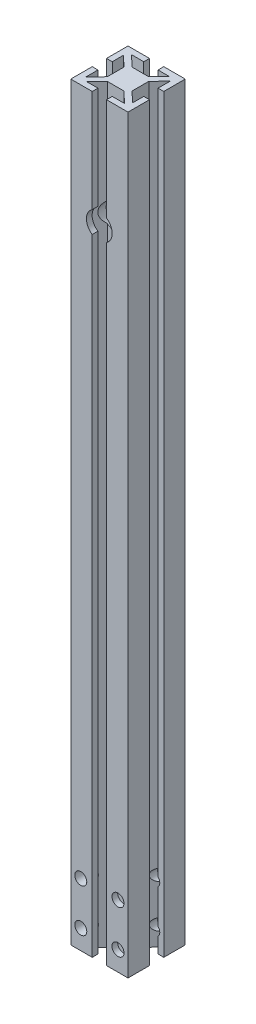
from build123d import *
from build123d.topology import SkipClean

# Parameters (mm, degrees)
SKETCH2_W           = 8.647603028
SKETCH2_H           = 8.647603028
BOSS_EXTRUDE1_DEPTH = 262
SKETCH4_R           = 2
CUT_EXTRUDE1_DEPTH  = 110
SKETCH5_R           = 4.5
CUT_EXTRUDE2_DEPTH  = 110
SKETCH7_R           = 2.1
CUT_EXTRUDE5_DEPTH  = 50


with BuildPart() as part:
    # Sketch2 → Boss-Extrude1 (new body)
    with BuildSketch(Plane(origin=(0, 0, 0), x_dir=(1, 0, 0), z_dir=(0, 1, 0))):
        Polygon((-10, -10), (-10, -2.5), (-8, -2.5), (-8, -6.768292683), (-4.358284272, -2.944491169), (-2.91000841, -4.323801514), (-6.424278868, -8), (-2.5, -8), (-2.5, -10), align=None)
        Polygon((-10, 2.5), (-10, 10), (-2.5, 10), (-2.5, 8), (-6.768292683, 8), (-2.944491169, 4.358284272), (-4.323801514, 2.91000841), (-8, 6.424278868), (-8, 2.5), align=None)
        Polygon((2.5, 10), (10, 10), (10, 2.5), (8, 2.5), (8, 6.768292683), (4.358284272, 2.944491169), (2.91000841, 4.323801514), (6.424278868, 8), (2.5, 8), align=None)
        Polygon((10, -2.5), (10, -10), (2.5, -10), (2.5, -8), (6.768292683, -8), (2.944491169, -4.358284272), (4.323801514, -2.91000841), (8, -6.424278868), (8, -2.5), align=None)
        Rectangle(SKETCH2_W, SKETCH2_H)
    extrude(amount=BOSS_EXTRUDE1_DEPTH)

    # Sketch4 → Cut-Extrude1 (cut)
    with BuildSketch(Plane(origin=(10, 0, 0), x_dir=(0, 0, -1), z_dir=(1, 0, 0))):
        with Locations((0.033661741, 197.6)):
            Circle(SKETCH4_R)
        with Locations((0.033661741, 177.6)):
            Circle(SKETCH4_R)
        with Locations((0.033661741, 210.6)):
            Circle(SKETCH4_R)
    extrude(amount=-CUT_EXTRUDE1_DEPTH, mode=Mode.SUBTRACT)

    # Sketch5 → Cut-Extrude2 (cut)
    with SkipClean():  # the faces are left unmerged after this step: merging them gives an invalid solid
        with BuildSketch(Plane(origin=(0, 0, -10), x_dir=(-1, 0, 0), z_dir=(0, 0, -1))):
            with Locations(Location((0.033661741, 222.49, 0), (0, 0, 49.14485179))):
                Circle(SKETCH5_R)
        extrude(amount=-CUT_EXTRUDE2_DEPTH, mode=Mode.SUBTRACT)

    # Sketch7 → Cut-Extrude5 (cut)
    with SkipClean():  # the faces are left unmerged after this step: merging them gives an invalid solid
        with BuildSketch(Plane(origin=(0, 0, -10), x_dir=(-1, 0, 0), z_dir=(0, 0, -1))):
            with Locations((6.5, 21.86112611)):
                Circle(SKETCH7_R)
            with Locations((6.5, 6.86112611)):
                Circle(SKETCH7_R)
            with Locations(Location((-6.5, 21.86112611, 0), (0, 0, 224.415308597))):
                Circle(SKETCH7_R)
            with Locations(Location((-6.5, 6.86112611, 0), (0, 0, 224.415308597))):
                Circle(SKETCH7_R)
        extrude(amount=-CUT_EXTRUDE5_DEPTH, mode=Mode.SUBTRACT)


solid = part.part
